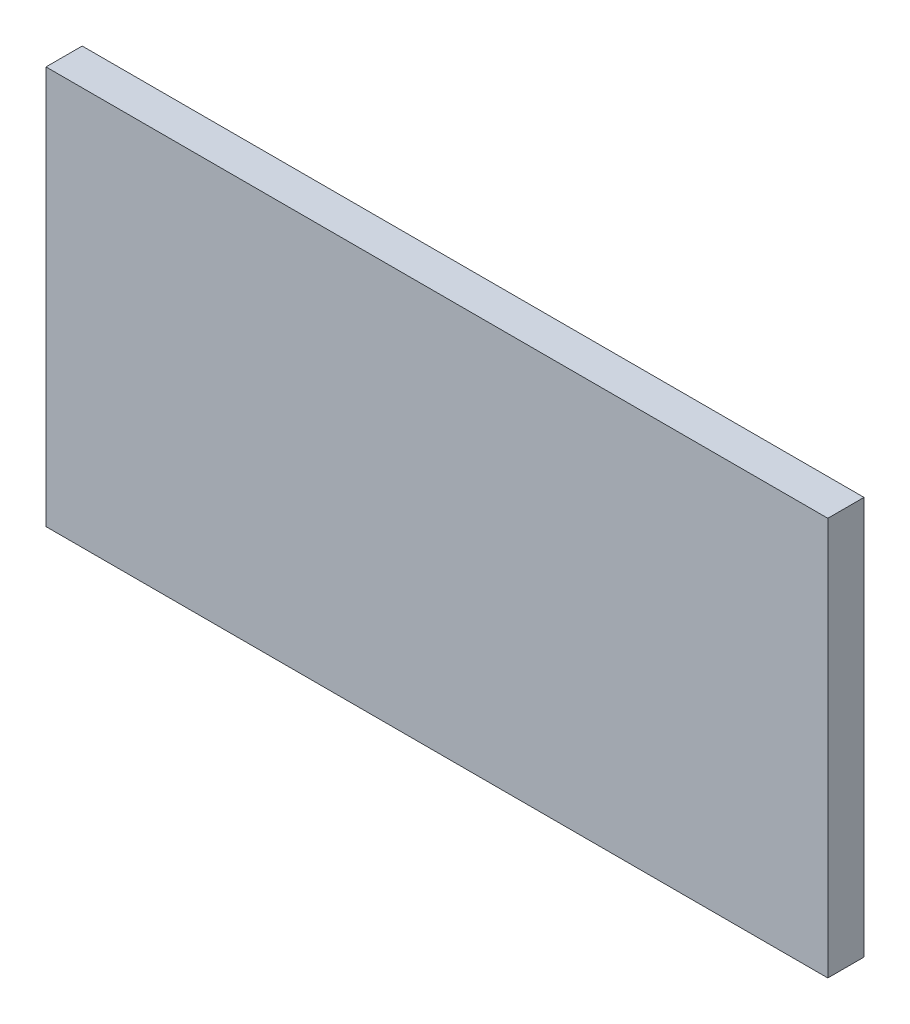
from build123d import *

# Parameters (mm, degrees)
SKETCH1_W           = 108
SKETCH1_H           = 55
BOSS_EXTRUDE1_DEPTH = 5


with BuildPart() as part:
    # Sketch1 → Boss-Extrude1 (new body)
    with BuildSketch(Plane.XY):
        Rectangle(SKETCH1_W, SKETCH1_H)
    extrude(amount=BOSS_EXTRUDE1_DEPTH)


solid = part.part
